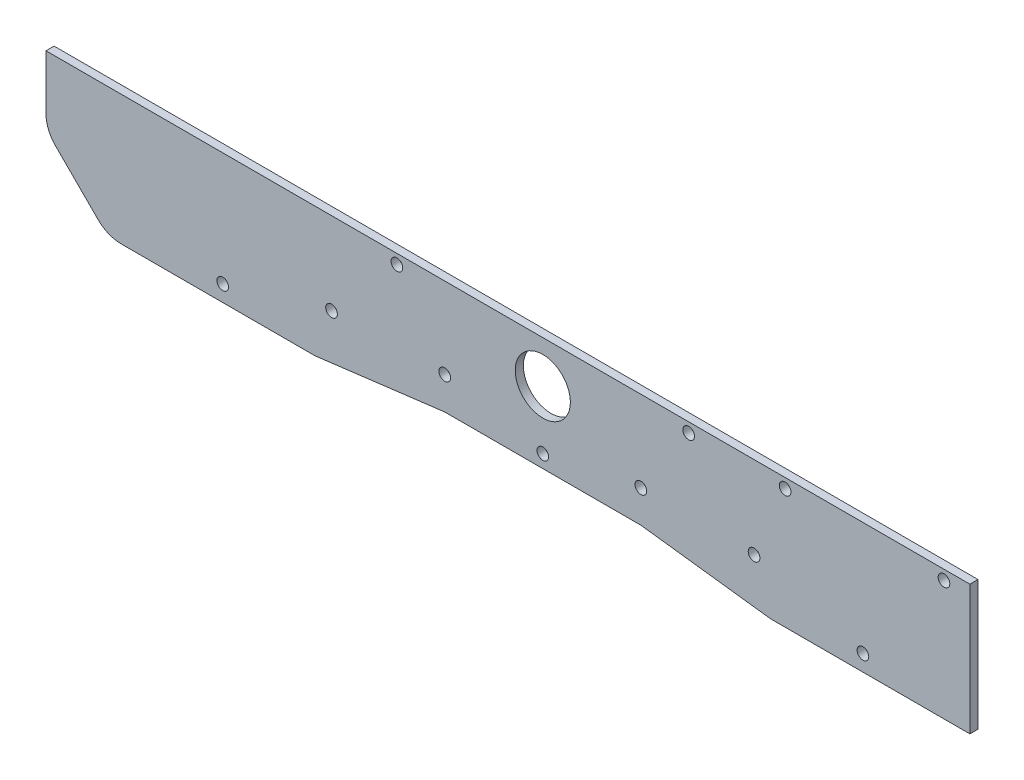
from build123d import *

# Parameters (mm, degrees)
SKETCH1_W           = 361.95
SKETCH1_H           = 50.8
SKETCH1_R           = 2.286
SKETCH1_R_2         = 10.795
BOSS_EXTRUDE1_DEPTH = 3.175
CUT_EXTRUDE1_DEPTH  = 366.511317369
FILLET1_R           = 12.7
CUT_EXTRUDE2_DEPTH  = 366.511317369
SKETCH4_R           = 2.286
CUT_EXTRUDE3_DEPTH  = 366.511317369
SKETCH6_R           = 2.286
CUT_EXTRUDE4_DEPTH  = 366.511317369


with BuildPart() as part:
    # Sketch1 → Boss-Extrude1 (new body)
    with BuildSketch(Plane.XY):
        with Locations((-180.975, 25.4)):
            Rectangle(SKETCH1_W, SKETCH1_H)
        with Locations((-41.91, 6.35)):
            Circle(SKETCH1_R, mode=Mode.SUBTRACT)
        with Locations((-292.735, 6.35)):
            Circle(SKETCH1_R, mode=Mode.SUBTRACT)
        with Locations((-128.905, 19.05)):
            Circle(SKETCH1_R, mode=Mode.SUBTRACT)
        with Locations((-205.74, 19.05)):
            Circle(SKETCH1_R, mode=Mode.SUBTRACT)
        with Locations((-167.3225, 34.29)):
            Circle(SKETCH1_R_2, mode=Mode.SUBTRACT)
        with Locations((-250.085181934, 18.50662125)):
            Circle(SKETCH1_R, mode=Mode.SUBTRACT)
        with Locations(Location((-84.559818066, 18.50662125, 0), (0, 0, 180))):
            Circle(SKETCH1_R, mode=Mode.SUBTRACT)
    extrude(amount=BOSS_EXTRUDE1_DEPTH)

    # Sketch2 → Cut-Extrude1 (cut, through all)
    with BuildSketch(Plane.XY.offset(3.175)):
        Polygon((-388.62, 50.8), (-337.82, 0), (-388.62, 0), align=None)
    extrude(amount=-CUT_EXTRUDE1_DEPTH, mode=Mode.SUBTRACT)

    # Fillet1
    fillet1_edges = [part.edges().sort_by_distance(p)[0] for p in [
        (-337.82, 0, 1.5875),
        (-361.95, 24.13, 1.5875),
    ]]
    fillet(fillet1_edges, radius=FILLET1_R)

    # Sketch3 → Cut-Extrude2 (cut, through all)
    with BuildSketch(Plane.XY.offset(3.175)):
        Polygon((-256.54, 0), (-205.74, 6.35), (-128.905, 6.35), (-78.105, 0), align=None)
    extrude(amount=-CUT_EXTRUDE2_DEPTH, mode=Mode.SUBTRACT)

    # Sketch4 → Cut-Extrude3 (cut, through all)
    with BuildSketch(Plane(origin=(0, 0, 0), x_dir=(-1, 0, 0), z_dir=(0, 0, -1))):
        with Locations((110.1725, 46.99)):
            Circle(SKETCH4_R)
        with Locations((167.3225, 11.43)):
            Circle(SKETCH4_R)
        with Locations((224.4725, 46.99)):
            Circle(SKETCH4_R)
    extrude(amount=-CUT_EXTRUDE3_DEPTH, mode=Mode.SUBTRACT)

    # Sketch6 → Cut-Extrude4 (cut, through all)
    with BuildSketch(Plane.XY.offset(3.175)):
        with Locations((-72.39, 46.99)):
            Circle(SKETCH6_R)
        with Locations((-10.16, 46.99)):
            Circle(SKETCH6_R)
    extrude(amount=-CUT_EXTRUDE4_DEPTH, mode=Mode.SUBTRACT)


solid = part.part
